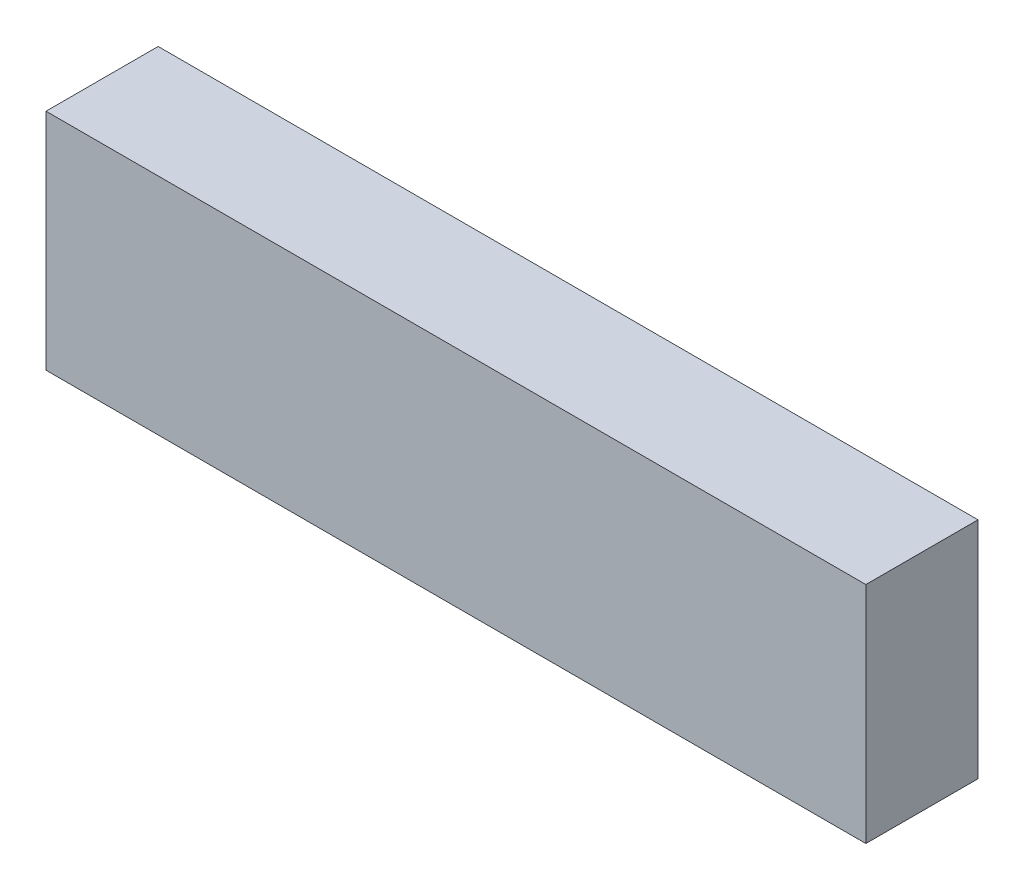
from build123d import *

# Parameters (mm, degrees)
SKETCH1_W           = 73.1
SKETCH1_H           = 20
BOSS_EXTRUDE1_DEPTH = 10


with BuildPart() as part:
    # Sketch1 → Boss-Extrude1 (new body)
    with BuildSketch(Plane.XY):
        with Locations((36.55, 10)):
            Rectangle(SKETCH1_W, SKETCH1_H)
    extrude(amount=-BOSS_EXTRUDE1_DEPTH)


solid = part.part
